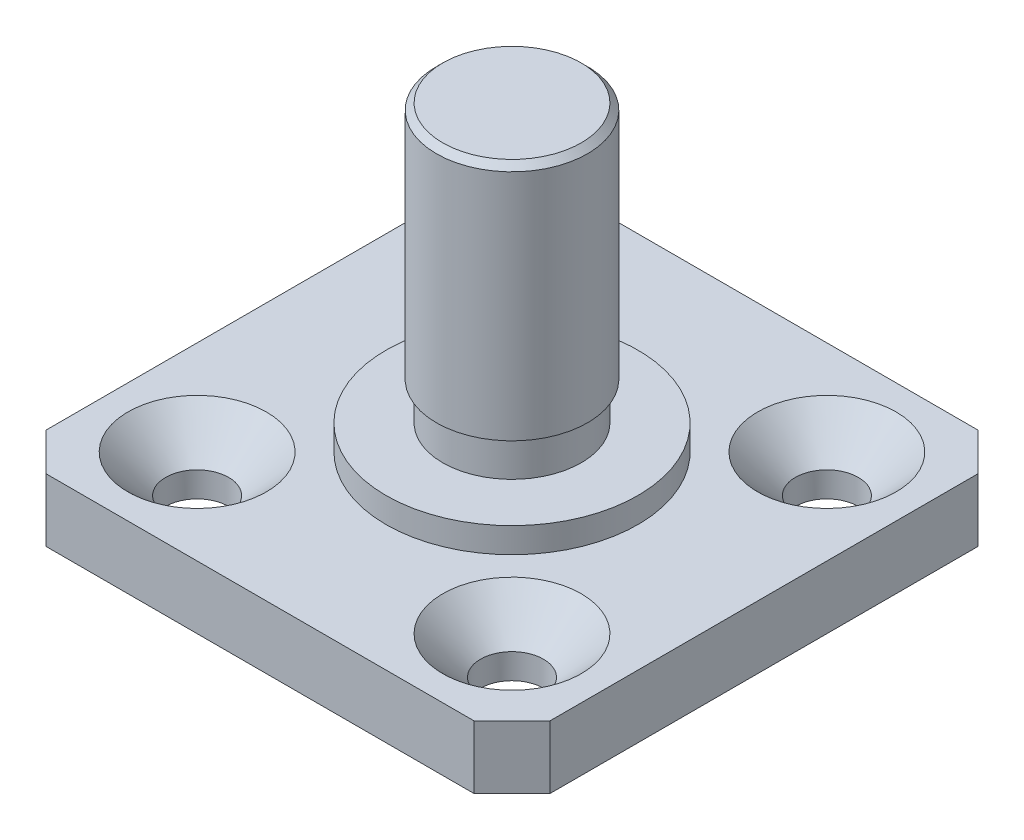
from build123d import *

# Parameters (mm, degrees)
SKETCH_1_W          = 40
SKETCH_1_H          = 40
EXTRUDE_1_DEPTH     = 5
CHAMFER_1_SIZE      = 3
SKETCH_2_R          = 10
EXTRUDE_2_DEPTH     = 2
SKETCH_3_R          = 6
EXTRUDE_3_DEPTH     = 22
SKETCH_4_R          = 6
SKETCH_4_R_2        = 5.5
CUT_EXTRUDE_1_DEPTH = 3
SKETCH_5_R          = 2.5
CUT_EXTRUDE_2_DEPTH = 38.094473982
CHAMFER_2_SIZE      = 3
CHAMFER_3_SIZE      = 0.5


with BuildPart() as part:
    # Эскиз1 → Бобышка-Вытянуть1 (new body)
    with BuildSketch(Plane(origin=(0, 0, 0), x_dir=(1, 0, 0), z_dir=(0, 1, 0))):
        Rectangle(SKETCH_1_W, SKETCH_1_H)
    extrude(amount=EXTRUDE_1_DEPTH)

    # Фаска1
    chamfer_1_edges = [part.edges().sort_by_distance(p)[0] for p in [
        (20, 2.5, 20),
        (-20, 2.5, 20),
        (-20, 2.5, -20),
        (20, 2.5, -20),
    ]]
    chamfer(chamfer_1_edges, length=CHAMFER_1_SIZE)

    # Эскиз2 → Бобышка-Вытянуть2 (add)
    with BuildSketch(Plane(origin=(0, 5, 0), x_dir=(1, 0, 0), z_dir=(0, 1, 0))):
        with Locations(Location((0, 0, 0), (0, 0, 270))):
            Circle(SKETCH_2_R)
    extrude(amount=EXTRUDE_2_DEPTH)

    # Эскиз3 → Бобышка-Вытянуть3 (add)
    with BuildSketch(Plane(origin=(0, 7, 0), x_dir=(1, 0, 0), z_dir=(0, 1, 0))):
        with Locations(Location((0, 0, 0), (0, 0, 270))):
            Circle(SKETCH_3_R)
    extrude(amount=EXTRUDE_3_DEPTH)

    # Эскиз4 → Вырез-Вытянуть1 (cut)
    with BuildSketch(Plane(origin=(0, 7, 0), x_dir=(1, 0, 0), z_dir=(0, 1, 0))):
        with Locations(Location((0, 0, 0), (0, 0, 270))):
            Circle(SKETCH_4_R)
        with Locations(Location((0, 0, 0), (0, 0, 270))):
            Circle(SKETCH_4_R_2, mode=Mode.SUBTRACT)
    extrude(amount=CUT_EXTRUDE_1_DEPTH, mode=Mode.SUBTRACT)

    # Эскиз5 → Вырез-Вытянуть2 (cut, through all)
    with BuildSketch(Plane(origin=(0, 5, 0), x_dir=(1, 0, 0), z_dir=(0, 1, 0))):
        with Locations(Location((-12.5, 12.5, 0), (0, 0, 270))):
            Circle(SKETCH_5_R)
        with Locations(Location((12.5, 12.5, 0), (0, 0, 270))):
            Circle(SKETCH_5_R)
        with Locations(Location((12.5, -12.5, 0), (0, 0, 270))):
            Circle(SKETCH_5_R)
        with Locations(Location((-12.5, -12.5, 0), (0, 0, 270))):
            Circle(SKETCH_5_R)
    extrude(amount=-CUT_EXTRUDE_2_DEPTH, mode=Mode.SUBTRACT)

    # Фаска2
    chamfer_2_edges = [part.edges().sort_by_distance(p)[0] for p in [
        (-12.5, 5, 10),
        (12.5, 5, 10),
        (12.5, 5, -15),
        (-12.5, 5, -15),
    ]]
    chamfer(chamfer_2_edges, length=CHAMFER_2_SIZE)

    # Фаска3
    chamfer_3_edges = [part.edges().sort_by_distance(p)[0] for p in [
        (0, 29, -6),
    ]]
    chamfer(chamfer_3_edges, length=CHAMFER_3_SIZE)


solid = part.part
